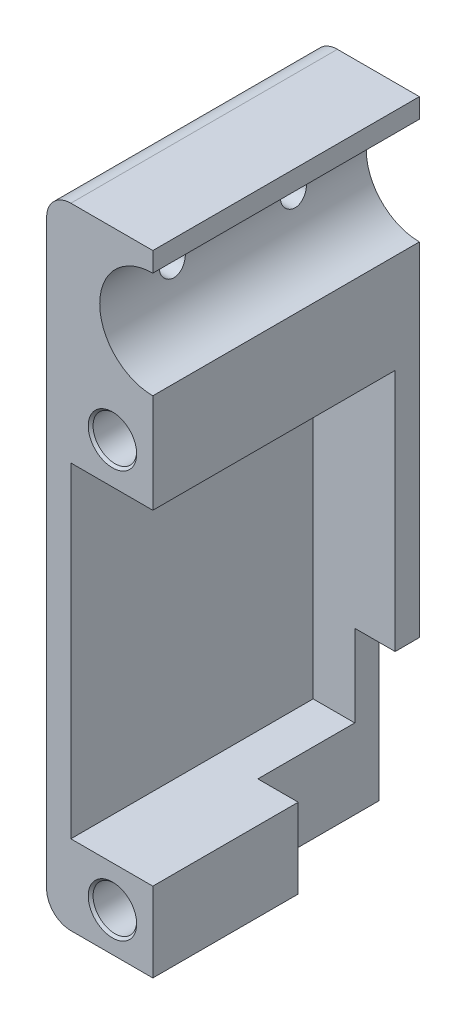
from build123d import *

# Parameters (mm, degrees)
SKETCH1_W           = 26.3
SKETCH1_H           = 60
SKETCH1_W_2         = 20.3
SKETCH1_H_2         = 40.3
BOSS_EXTRUDE1_DEPTH = 30
BOSS_EXTRUDE2_START = -30
SKETCH1_2_W         = 26.3
SKETCH1_2_H         = 60
BOSS_EXTRUDE2_DEPTH = 3
SKETCH2_W           = 26.3
SKETCH2_H           = 18
SKETCH2_R           = 6.575
BOSS_EXTRUDE3_DEPTH = 33
SKETCH3_W           = 10
SKETCH3_H           = 15
CUT_EXTRUDE1_DEPTH  = 20
CUT_EXTRUDE2_DEPTH  = 64.911579545
FILLET1_R           = 3
SKETCH5_R           = 2.7
CUT_EXTRUDE4_DEPTH  = 4.2
CHAMFER1_SIZE       = 0.3


with BuildPart() as part:
    # Sketch1 → Boss-Extrude1 (new body)
    with BuildSketch(Plane.XY):
        Rectangle(SKETCH1_W, SKETCH1_H)
        Rectangle(SKETCH1_W_2, SKETCH1_H_2, mode=Mode.SUBTRACT)
    extrude(amount=-BOSS_EXTRUDE1_DEPTH)

    # Sketch1<2> → Boss-Extrude2 (add)
    with BuildSketch(Plane.XY.offset(BOSS_EXTRUDE2_START)):
        Rectangle(SKETCH1_2_W, SKETCH1_2_H)
    extrude(amount=-BOSS_EXTRUDE2_DEPTH)

    # Sketch2 → Boss-Extrude3 (add)
    with BuildSketch(Plane.XY):
        with Locations((0, 39)):
            Rectangle(SKETCH2_W, SKETCH2_H)
        with Locations((0, 39)):
            Circle(SKETCH2_R, mode=Mode.SUBTRACT)
    extrude(amount=-BOSS_EXTRUDE3_DEPTH)

    # Sketch3 → Cut-Extrude1 (cut)
    with BuildSketch(Plane.XZ.offset(30)):
        with Locations((0, -25.5)):
            Rectangle(SKETCH3_W, SKETCH3_H)
    extrude(amount=-CUT_EXTRUDE1_DEPTH, mode=Mode.SUBTRACT)

    # Sketch4 → Cut-Extrude2 (cut, through all)
    with BuildSketch(Plane(origin=(13.15, 0, 0), x_dir=(0, 0, -1), z_dir=(1, 0, 0))):
        with BuildLine():
            ThreePointArc((7.4, 39), (9, 37.4), (10.6, 39))
            Line((10.6, 39), (7.4, 39))
        make_face()
        with BuildLine():
            Line((7.4, 39), (10.6, 39))
            ThreePointArc((10.6, 39), (9, 40.6), (7.4, 39))
        make_face()
        with BuildLine():
            ThreePointArc((22.4, 39), (24, 37.4), (25.6, 39))
            Line((25.6, 39), (22.4, 39))
        make_face()
        with BuildLine():
            Line((22.4, 39), (25.6, 39))
            ThreePointArc((25.6, 39), (24, 40.6), (22.4, 39))
        make_face()
    extrude(amount=-CUT_EXTRUDE2_DEPTH, mode=Mode.SUBTRACT)

    # Fillet1
    fillet1_edges = [part.edges().sort_by_distance(p)[0] for p in [
        (-13.15, 48, -16.5),
        (13.15, 48, -16.5),
        (13.15, -30, -16.5),
        (-13.15, -30, -16.5),
    ]]
    fillet(fillet1_edges, radius=FILLET1_R)

    # SurfaceCut2
    split(bisect_by=Plane.ZY, keep=Keep.TOP)

    # Sketch5 → Cut-Extrude4 (cut)
    with BuildSketch(Plane.XY):
        with Locations((-5, -25.2)):
            Circle(SKETCH5_R)
        with Locations((-5, 25.2)):
            Circle(SKETCH5_R)
    extrude(amount=-CUT_EXTRUDE4_DEPTH, mode=Mode.SUBTRACT)

    # Chamfer1
    chamfer1_edges = [part.edges().sort_by_distance(p)[0] for p in [
        (-7.7, -25.2, 0),
        (-7.7, 25.2, 0),
    ]]
    chamfer(chamfer1_edges, length=CHAMFER1_SIZE)


solid = part.part
